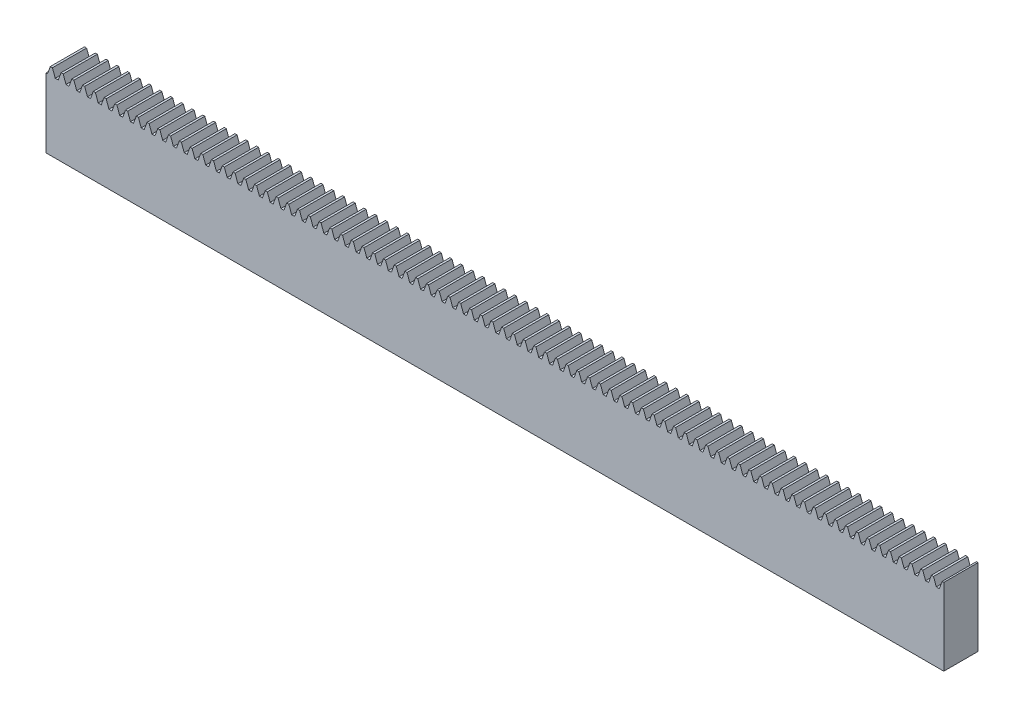
from build123d import *

# Parameters (mm, degrees)
BOSS_EXTRUDE1_DEPTH = 8
SKETCH2_W           = 215
SKETCH2_H           = 18
CUT_EXTRUDE1_DEPTH  = 426.456225715


with BuildPart() as part:
    # Sketch1 → Boss-Extrude1 (new body)
    with BuildSketch(Plane(origin=(0, 0, -8), x_dir=(-1, 0, 0), z_dir=(0, 0, -1))):
        Polygon((-423.733831563, 18), (-424.388977984, 16.2), (-425, 16.2), (-425, 0), (0, 0), (0, 16.2), (-0.354348296, 16.2), (-1.009494717, 18), (-1.503779403, 18), (-2.158925824, 16.2), (-2.867622416, 16.2), (-3.522768837, 18), (-4.017053523, 18), (-4.672199944, 16.2), (-5.380896536, 16.2), (-6.036042957, 18), (-6.530327643, 18), (-7.185474064, 16.2), (-7.894170656, 16.2), (-8.549317077, 18), (-9.043601763, 18), (-9.698748184, 16.2), (-10.407444776, 16.2), (-11.062591197, 18), (-11.556875883, 18), (-12.212022304, 16.2), (-12.920718896, 16.2), (-13.575865317, 18), (-14.070150003, 18), (-14.725296424, 16.2), (-15.433993016, 16.2), (-16.089139437, 18), (-16.583424123, 18), (-17.238570544, 16.2), (-17.947267136, 16.2), (-18.602413557, 18), (-19.096698243, 18), (-19.751844664, 16.2), (-20.460541256, 16.2), (-21.115687677, 18), (-21.609972363, 18), (-22.265118784, 16.2), (-22.973815376, 16.2), (-23.628961797, 18), (-24.123246483, 18), (-24.778392904, 16.2), (-25.487089496, 16.2), (-26.142235917, 18), (-26.636520603, 18), (-27.291667024, 16.2), (-28.000363616, 16.2), (-28.655510037, 18), (-29.149794723, 18), (-29.804941144, 16.2), (-30.513637736, 16.2), (-31.168784157, 18), (-31.663068843, 18), (-32.318215264, 16.2), (-33.026911856, 16.2), (-33.682058277, 18), (-34.176342963, 18), (-34.831489384, 16.2), (-35.540185976, 16.2), (-36.195332397, 18), (-36.689617083, 18), (-37.344763504, 16.2), (-38.053460096, 16.2), (-38.708606517, 18), (-39.202891203, 18), (-39.858037624, 16.2), (-40.566734216, 16.2), (-41.221880637, 18), (-41.716165323, 18), (-42.371311744, 16.2), (-43.080008336, 16.2), (-43.735154757, 18), (-44.229439443, 18), (-44.884585864, 16.2), (-45.593282456, 16.2), (-46.248428877, 18), (-46.742713563, 18), (-47.397859984, 16.2), (-48.106556576, 16.2), (-48.761702997, 18), (-49.255987683, 18), (-49.911134104, 16.2), (-50.619830696, 16.2), (-51.274977117, 18), (-51.769261803, 18), (-52.424408224, 16.2), (-53.133104816, 16.2), (-53.788251237, 18), (-54.282535923, 18), (-54.937682344, 16.2), (-55.646378936, 16.2), (-56.301525357, 18), (-56.795810043, 18), (-57.450956464, 16.2), (-58.159653056, 16.2), (-58.814799477, 18), (-59.309084163, 18), (-59.964230584, 16.2), (-60.672927176, 16.2), (-61.328073597, 18), (-61.822358283, 18), (-62.477504704, 16.2), (-63.186201296, 16.2), (-63.841347717, 18), (-64.335632403, 18), (-64.990778824, 16.2), (-65.699475416, 16.2), (-66.354621837, 18), (-66.848906523, 18), (-67.504052944, 16.2), (-68.212749536, 16.2), (-68.867895957, 18), (-69.362180643, 18), (-70.017327064, 16.2), (-70.726023656, 16.2), (-71.381170077, 18), (-71.875454763, 18), (-72.530601184, 16.2), (-73.239297776, 16.2), (-73.894444197, 18), (-74.388728883, 18), (-75.043875304, 16.2), (-75.752571896, 16.2), (-76.407718317, 18), (-76.902003003, 18), (-77.557149424, 16.2), (-78.265846016, 16.2), (-78.920992437, 18), (-79.415277123, 18), (-80.070423544, 16.2), (-80.779120136, 16.2), (-81.434266557, 18), (-81.928551243, 18), (-82.583697664, 16.2), (-83.292394256, 16.2), (-83.947540677, 18), (-84.441825363, 18), (-85.096971784, 16.2), (-85.805668376, 16.2), (-86.460814797, 18), (-86.955099483, 18), (-87.610245904, 16.2), (-88.318942496, 16.2), (-88.974088917, 18), (-89.468373603, 18), (-90.123520024, 16.2), (-90.832216616, 16.2), (-91.487363037, 18), (-91.981647723, 18), (-92.636794144, 16.2), (-93.345490736, 16.2), (-94.000637157, 18), (-94.494921843, 18), (-95.150068264, 16.2), (-95.858764856, 16.2), (-96.513911277, 18), (-97.008195963, 18), (-97.663342384, 16.2), (-98.372038976, 16.2), (-99.027185397, 18), (-99.521470083, 18), (-100.176616504, 16.2), (-100.885313096, 16.2), (-101.540459517, 18), (-102.034744203, 18), (-102.689890624, 16.2), (-103.398587216, 16.2), (-104.053733637, 18), (-104.548018323, 18), (-105.203164744, 16.2), (-105.911861336, 16.2), (-106.567007757, 18), (-107.061292443, 18), (-107.716438864, 16.2), (-108.425135456, 16.2), (-109.080281877, 18), (-109.574566563, 18), (-110.229712984, 16.2), (-110.938409576, 16.2), (-111.593555997, 18), (-112.087840683, 18), (-112.742987104, 16.2), (-113.451683696, 16.2), (-114.106830117, 18), (-114.601114803, 18), (-115.256261224, 16.2), (-115.964957816, 16.2), (-116.620104237, 18), (-117.114388923, 18), (-117.769535344, 16.2), (-118.478231936, 16.2), (-119.133378357, 18), (-119.627663043, 18), (-120.282809464, 16.2), (-120.991506056, 16.2), (-121.646652477, 18), (-122.140937163, 18), (-122.796083584, 16.2), (-123.504780176, 16.2), (-124.159926597, 18), (-124.654211283, 18), (-125.309357704, 16.2), (-126.018054296, 16.2), (-126.673200717, 18), (-127.167485403, 18), (-127.822631824, 16.2), (-128.531328416, 16.2), (-129.186474837, 18), (-129.680759523, 18), (-130.335905944, 16.2), (-131.044602536, 16.2), (-131.699748957, 18), (-132.194033643, 18), (-132.849180064, 16.2), (-133.557876656, 16.2), (-134.213023077, 18), (-134.707307763, 18), (-135.362454184, 16.2), (-136.071150776, 16.2), (-136.726297197, 18), (-137.220581883, 18), (-137.875728304, 16.2), (-138.584424896, 16.2), (-139.239571317, 18), (-139.733856003, 18), (-140.389002424, 16.2), (-141.097699016, 16.2), (-141.752845437, 18), (-142.247130123, 18), (-142.902276544, 16.2), (-143.610973136, 16.2), (-144.266119557, 18), (-144.760404243, 18), (-145.415550664, 16.2), (-146.124247256, 16.2), (-146.779393677, 18), (-147.273678363, 18), (-147.928824784, 16.2), (-148.637521376, 16.2), (-149.292667797, 18), (-149.786952483, 18), (-150.442098904, 16.2), (-151.150795496, 16.2), (-151.805941917, 18), (-152.300226603, 18), (-152.955373024, 16.2), (-153.664069616, 16.2), (-154.319216037, 18), (-154.813500723, 18), (-155.468647144, 16.2), (-156.177343736, 16.2), (-156.832490157, 18), (-157.326774843, 18), (-157.981921264, 16.2), (-158.690617856, 16.2), (-159.345764277, 18), (-159.840048963, 18), (-160.495195384, 16.2), (-161.203891976, 16.2), (-161.859038397, 18), (-162.353323083, 18), (-163.008469504, 16.2), (-163.717166096, 16.2), (-164.372312517, 18), (-164.866597203, 18), (-165.521743624, 16.2), (-166.230440216, 16.2), (-166.885586637, 18), (-167.379871323, 18), (-168.035017744, 16.2), (-168.743714336, 16.2), (-169.398860757, 18), (-169.893145443, 18), (-170.548291864, 16.2), (-171.256988456, 16.2), (-171.912134877, 18), (-172.406419563, 18), (-173.061565984, 16.2), (-173.770262576, 16.2), (-174.425408997, 18), (-174.919693683, 18), (-175.574840104, 16.2), (-176.283536696, 16.2), (-176.938683117, 18), (-177.432967803, 18), (-178.088114224, 16.2), (-178.796810816, 16.2), (-179.451957237, 18), (-179.946241923, 18), (-180.601388344, 16.2), (-181.310084936, 16.2), (-181.965231357, 18), (-182.459516043, 18), (-183.114662464, 16.2), (-183.823359056, 16.2), (-184.478505477, 18), (-184.972790163, 18), (-185.627936584, 16.2), (-186.336633176, 16.2), (-186.991779597, 18), (-187.486064283, 18), (-188.141210704, 16.2), (-188.849907296, 16.2), (-189.505053717, 18), (-189.999338403, 18), (-190.654484824, 16.2), (-191.363181416, 16.2), (-192.018327837, 18), (-192.512612523, 18), (-193.167758944, 16.2), (-193.876455536, 16.2), (-194.531601957, 18), (-195.025886643, 18), (-195.681033064, 16.2), (-196.389729656, 16.2), (-197.044876077, 18), (-197.539160763, 18), (-198.194307184, 16.2), (-198.903003776, 16.2), (-199.558150197, 18), (-200.052434883, 18), (-200.707581304, 16.2), (-201.416277896, 16.2), (-202.071424317, 18), (-202.565709003, 18), (-203.220855424, 16.2), (-203.929552016, 16.2), (-204.584698437, 18), (-205.078983123, 18), (-205.734129544, 16.2), (-206.442826136, 16.2), (-207.097972557, 18), (-207.592257243, 18), (-208.247403664, 16.2), (-208.956100256, 16.2), (-209.611246677, 18), (-210.105531363, 18), (-210.760677784, 16.2), (-211.469374376, 16.2), (-212.124520797, 18), (-212.618805483, 18), (-213.273951904, 16.2), (-213.982648496, 16.2), (-214.637794917, 18), (-215.132079603, 18), (-215.787226024, 16.2), (-216.495922616, 16.2), (-217.151069037, 18), (-217.645353723, 18), (-218.300500144, 16.2), (-219.009196736, 16.2), (-219.664343157, 18), (-220.158627843, 18), (-220.813774264, 16.2), (-221.522470856, 16.2), (-222.177617277, 18), (-222.671901963, 18), (-223.327048384, 16.2), (-224.035744976, 16.2), (-224.690891397, 18), (-225.185176083, 18), (-225.840322504, 16.2), (-226.549019096, 16.2), (-227.204165517, 18), (-227.698450203, 18), (-228.353596624, 16.2), (-229.062293216, 16.2), (-229.717439637, 18), (-230.211724323, 18), (-230.866870744, 16.2), (-231.575567336, 16.2), (-232.230713757, 18), (-232.724998443, 18), (-233.380144864, 16.2), (-234.088841456, 16.2), (-234.743987877, 18), (-235.238272563, 18), (-235.893418984, 16.2), (-236.602115576, 16.2), (-237.257261997, 18), (-237.751546683, 18), (-238.406693104, 16.2), (-239.115389696, 16.2), (-239.770536117, 18), (-240.264820803, 18), (-240.919967224, 16.2), (-241.628663816, 16.2), (-242.283810237, 18), (-242.778094923, 18), (-243.433241344, 16.2), (-244.141937936, 16.2), (-244.797084357, 18), (-245.291369043, 18), (-245.946515464, 16.2), (-246.655212056, 16.2), (-247.310358477, 18), (-247.804643163, 18), (-248.459789584, 16.2), (-249.168486176, 16.2), (-249.823632597, 18), (-250.317917283, 18), (-250.973063704, 16.2), (-251.681760296, 16.2), (-252.336906717, 18), (-252.831191403, 18), (-253.486337824, 16.2), (-254.195034416, 16.2), (-254.850180837, 18), (-255.344465523, 18), (-255.999611944, 16.2), (-256.708308536, 16.2), (-257.363454957, 18), (-257.857739643, 18), (-258.512886064, 16.2), (-259.221582656, 16.2), (-259.876729077, 18), (-260.371013763, 18), (-261.026160184, 16.2), (-261.734856776, 16.2), (-262.390003197, 18), (-262.884287883, 18), (-263.539434304, 16.2), (-264.248130896, 16.2), (-264.903277317, 18), (-265.397562003, 18), (-266.052708424, 16.2), (-266.761405016, 16.2), (-267.416551437, 18), (-267.910836123, 18), (-268.565982544, 16.2), (-269.274679136, 16.2), (-269.929825557, 18), (-270.424110243, 18), (-271.079256664, 16.2), (-271.787953256, 16.2), (-272.443099677, 18), (-272.937384363, 18), (-273.592530784, 16.2), (-274.301227376, 16.2), (-274.956373797, 18), (-275.450658483, 18), (-276.105804904, 16.2), (-276.814501496, 16.2), (-277.469647917, 18), (-277.963932603, 18), (-278.619079024, 16.2), (-279.327775616, 16.2), (-279.982922037, 18), (-280.477206723, 18), (-281.132353144, 16.2), (-281.841049736, 16.2), (-282.496196157, 18), (-282.990480843, 18), (-283.645627264, 16.2), (-284.354323856, 16.2), (-285.009470277, 18), (-285.503754963, 18), (-286.158901384, 16.2), (-286.867597976, 16.2), (-287.522744397, 18), (-288.017029083, 18), (-288.672175504, 16.2), (-289.380872096, 16.2), (-290.036018517, 18), (-290.530303203, 18), (-291.185449624, 16.2), (-291.894146216, 16.2), (-292.549292637, 18), (-293.043577323, 18), (-293.698723744, 16.2), (-294.407420336, 16.2), (-295.062566757, 18), (-295.556851443, 18), (-296.211997864, 16.2), (-296.920694456, 16.2), (-297.575840877, 18), (-298.070125563, 18), (-298.725271984, 16.2), (-299.433968576, 16.2), (-300.089114997, 18), (-300.583399683, 18), (-301.238546104, 16.2), (-301.947242696, 16.2), (-302.602389117, 18), (-303.096673803, 18), (-303.751820224, 16.2), (-304.460516816, 16.2), (-305.115663237, 18), (-305.609947923, 18), (-306.265094344, 16.2), (-306.973790936, 16.2), (-307.628937357, 18), (-308.123222043, 18), (-308.778368464, 16.2), (-309.487065056, 16.2), (-310.142211477, 18), (-310.636496163, 18), (-311.291642584, 16.2), (-312.000339176, 16.2), (-312.655485597, 18), (-313.149770283, 18), (-313.804916704, 16.2), (-314.513613296, 16.2), (-315.168759717, 18), (-315.663044403, 18), (-316.318190824, 16.2), (-317.026887416, 16.2), (-317.682033837, 18), (-318.176318523, 18), (-318.831464944, 16.2), (-319.540161536, 16.2), (-320.195307957, 18), (-320.689592643, 18), (-321.344739064, 16.2), (-322.053435656, 16.2), (-322.708582077, 18), (-323.202866763, 18), (-323.858013184, 16.2), (-324.566709776, 16.2), (-325.221856197, 18), (-325.716140883, 18), (-326.371287304, 16.2), (-327.079983896, 16.2), (-327.735130317, 18), (-328.229415003, 18), (-328.884561424, 16.2), (-329.593258016, 16.2), (-330.248404437, 18), (-330.742689123, 18), (-331.397835544, 16.2), (-332.106532136, 16.2), (-332.761678557, 18), (-333.255963243, 18), (-333.911109664, 16.2), (-334.619806256, 16.2), (-335.274952677, 18), (-335.769237363, 18), (-336.424383784, 16.2), (-337.133080376, 16.2), (-337.788226797, 18), (-338.282511483, 18), (-338.937657904, 16.2), (-339.646354496, 16.2), (-340.301500917, 18), (-340.795785603, 18), (-341.450932024, 16.2), (-342.159628616, 16.2), (-342.814775037, 18), (-343.309059723, 18), (-343.964206144, 16.2), (-344.672902736, 16.2), (-345.328049157, 18), (-345.822333843, 18), (-346.477480264, 16.2), (-347.186176856, 16.2), (-347.841323277, 18), (-348.335607963, 18), (-348.990754384, 16.2), (-349.699450976, 16.2), (-350.354597397, 18), (-350.848882083, 18), (-351.504028504, 16.2), (-352.212725096, 16.2), (-352.867871517, 18), (-353.362156203, 18), (-354.017302624, 16.2), (-354.725999216, 16.2), (-355.381145637, 18), (-355.875430323, 18), (-356.530576744, 16.2), (-357.239273336, 16.2), (-357.894419757, 18), (-358.388704443, 18), (-359.043850864, 16.2), (-359.752547456, 16.2), (-360.407693877, 18), (-360.901978563, 18), (-361.557124984, 16.2), (-362.265821576, 16.2), (-362.920967997, 18), (-363.415252683, 18), (-364.070399104, 16.2), (-364.779095696, 16.2), (-365.434242117, 18), (-365.928526803, 18), (-366.583673224, 16.2), (-367.292369816, 16.2), (-367.947516237, 18), (-368.441800923, 18), (-369.096947344, 16.2), (-369.805643936, 16.2), (-370.460790357, 18), (-370.955075043, 18), (-371.610221464, 16.2), (-372.318918056, 16.2), (-372.974064477, 18), (-373.468349163, 18), (-374.123495584, 16.2), (-374.832192176, 16.2), (-375.487338597, 18), (-375.981623283, 18), (-376.636769704, 16.2), (-377.345466296, 16.2), (-378.000612717, 18), (-378.494897403, 18), (-379.150043824, 16.2), (-379.858740416, 16.2), (-380.513886837, 18), (-381.008171523, 18), (-381.663317944, 16.2), (-382.372014536, 16.2), (-383.027160957, 18), (-383.521445643, 18), (-384.176592064, 16.2), (-384.885288656, 16.2), (-385.540435077, 18), (-386.034719763, 18), (-386.689866184, 16.2), (-387.398562776, 16.2), (-388.053709197, 18), (-388.547993883, 18), (-389.203140304, 16.2), (-389.911836896, 16.2), (-390.566983317, 18), (-391.061268003, 18), (-391.716414424, 16.2), (-392.425111016, 16.2), (-393.080257437, 18), (-393.574542123, 18), (-394.229688544, 16.2), (-394.938385136, 16.2), (-395.593531557, 18), (-396.087816243, 18), (-396.742962664, 16.2), (-397.451659256, 16.2), (-398.106805677, 18), (-398.601090363, 18), (-399.256236784, 16.2), (-399.964933376, 16.2), (-400.620079797, 18), (-401.114364483, 18), (-401.769510904, 16.2), (-402.478207496, 16.2), (-403.133353917, 18), (-403.627638603, 18), (-404.282785024, 16.2), (-404.991481616, 16.2), (-405.646628037, 18), (-406.140912723, 18), (-406.796059144, 16.2), (-407.504755736, 16.2), (-408.159902157, 18), (-408.654186843, 18), (-409.309333264, 16.2), (-410.018029856, 16.2), (-410.673176277, 18), (-411.167460963, 18), (-411.822607384, 16.2), (-412.531303976, 16.2), (-413.186450397, 18), (-413.680735083, 18), (-414.335881504, 16.2), (-415.044578096, 16.2), (-415.699724517, 18), (-416.194009203, 18), (-416.849155624, 16.2), (-417.557852216, 16.2), (-418.212998637, 18), (-418.707283323, 18), (-419.362429744, 16.2), (-420.071126336, 16.2), (-420.726272757, 18), (-421.220557443, 18), (-421.875703864, 16.2), (-422.584400456, 16.2), (-423.239546877, 18), align=None)
    extrude(amount=-BOSS_EXTRUDE1_DEPTH)

    # Sketch2 → Cut-Extrude1 (cut, through all)
    with BuildSketch(Plane.XY):
        with Locations((317.5, 9)):
            Rectangle(SKETCH2_W, SKETCH2_H)
    extrude(amount=-CUT_EXTRUDE1_DEPTH, mode=Mode.SUBTRACT)


solid = part.part
